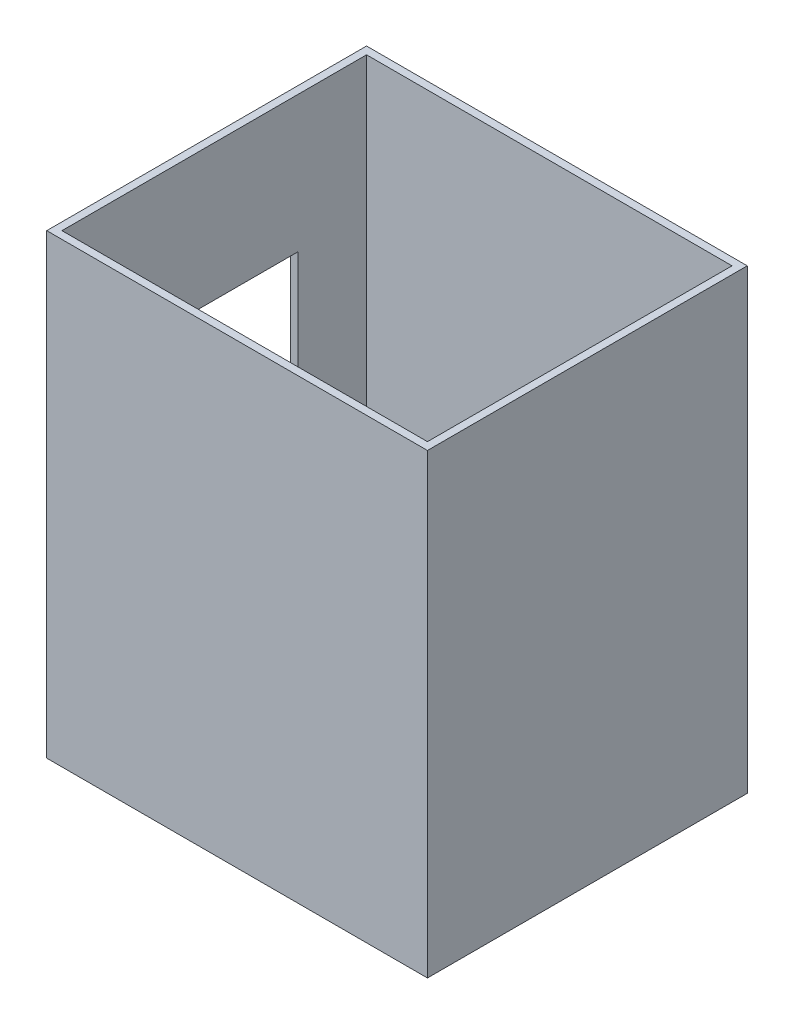
from build123d import *

# Parameters (mm, degrees)
SKETCH1_W           = 2500
SKETCH1_H           = 2100
BOSS_EXTRUDE1_DEPTH = 3000
SHELL1_T            = -50
SKETCH2_W           = 1100
SKETCH2_H           = 2100
CUT_EXTRUDE1_DEPTH  = 50


with BuildPart() as part:
    # Sketch1 → Boss-Extrude1 (new body)
    with BuildSketch(Plane(origin=(0, 0, 0), x_dir=(1, 0, 0), z_dir=(0, 1, 0))):
        Rectangle(SKETCH1_W, SKETCH1_H)
    extrude(amount=BOSS_EXTRUDE1_DEPTH)

    # Shell1
    shell1_openings = [part.faces().sort_by_distance(p)[0] for p in [
        (0, 3000, 0),
    ]]
    offset(amount=SHELL1_T, openings=shell1_openings, kind=Kind.INTERSECTION)

    # Sketch2 → Cut-Extrude1 (cut)
    with BuildSketch(Plane.ZY.offset(1250)):
        with Locations((0, 1055)):
            Rectangle(SKETCH2_W, SKETCH2_H)
    extrude(amount=-CUT_EXTRUDE1_DEPTH, mode=Mode.SUBTRACT)


solid = part.part
